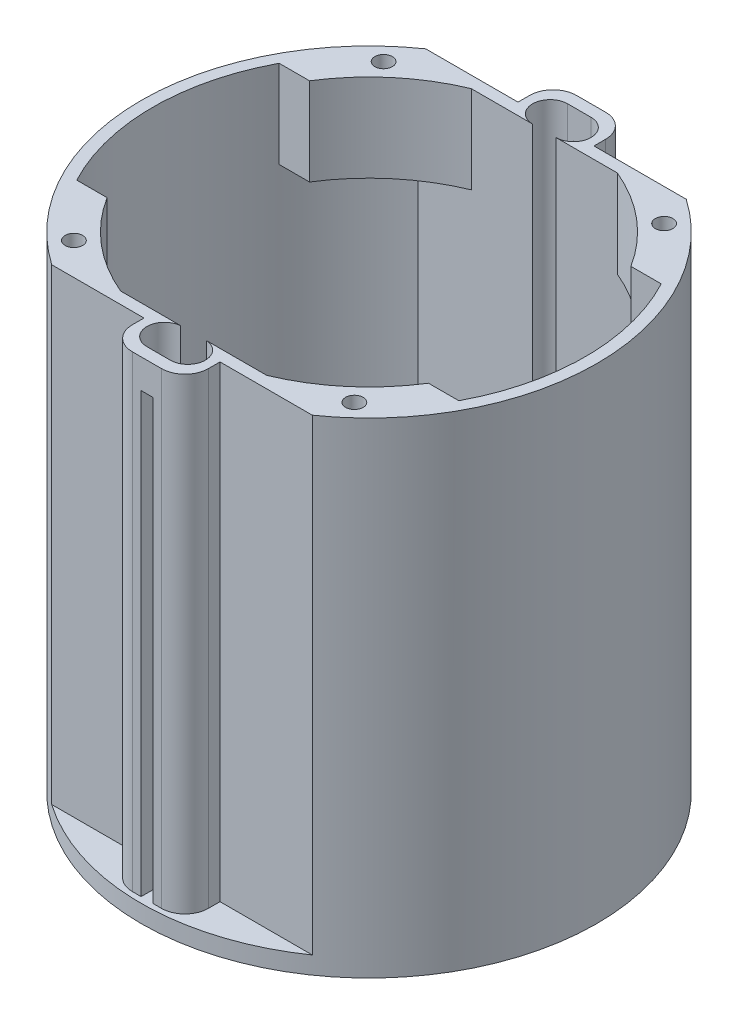
from build123d import *
from build123d.topology import SkipClean

# Parameters (mm, degrees)
SALIENTE_EXTRUIR2_DEPTH   = 80
SALIENTE_EXTRUIR2_2_DEPTH = 80
SALIENTE_EXTRUIR2_3_DEPTH = 80
SALIENTE_EXTRUIR2_4_DEPTH = 80
CROQUIS1_4_R              = 47
CROQUIS1_4_R_2            = 30
SALIENTE_EXTRUIR3_DEPTH   = 3
CROQUIS2_R                = 47
SALIENTE_EXTRUIR4_DEPTH   = 3
CROQUIS3_R                = 1.5
CORTAR_EXTRUIR1_DEPTH     = 7
SALIENTE_EXTRUIR6_DEPTH   = 80
CROQUIS8_W                = 18.419871589
CROQUIS8_H                = 3
SALIENTE_EXTRUIR7_DEPTH   = 2
CROQUIS9_W                = 18.419871589
CROQUIS9_H                = 3
SALIENTE_EXTRUIR8_DEPTH   = 2
CROQUIS10_W               = 18.419871589
CROQUIS10_H               = 3
SALIENTE_EXTRUIR9_DEPTH   = 2
CROQUIS11_W               = 18.419871589
CROQUIS11_H               = 3
SALIENTE_EXTRUIR10_DEPTH  = 2
CORTAR_EXTRUIR2_START     = -4
CROQUIS12_R               = 40.558599581
CROQUIS12_R_2             = 39
CORTAR_EXTRUIR2_DEPTH     = 4
CROQUIS13_W               = 2
CROQUIS13_H               = 5
SALIENTE_EXTRUIR11_DEPTH  = 2
CROQUIS14_W               = 2
CROQUIS14_H               = 5
SALIENTE_EXTRUIR12_DEPTH  = 2
CORTAR_EXTRUIR3_START     = -3
CROQUIS15_R               = 47
CROQUIS15_R_2             = 39
CORTAR_EXTRUIR3_DEPTH     = 3
CROQUIS16_R               = 1.75
CORTAR_EXTRUIR4_DEPTH     = 3
SALIENTE_EXTRUIR13_DEPTH  = 80
CORTAR_EXTRUIR5_DEPTH     = 80
SALIENTE_EXTRUIR14_DEPTH  = 80
SALIENTE_EXTRUIR16_START  = -80
SALIENTE_EXTRUIR16_DEPTH  = 80
CORTAR_EXTRUIR6_DEPTH     = 65
CORTAR_EXTRUIR7_START     = -65
CORTAR_EXTRUIR7_DEPTH     = 65


with BuildPart() as part:
    # Croquis1 → Saliente-Extruir2 (new body)
    with BuildSketch(Plane(origin=(0, 0, 0), x_dir=(1, 0, 0), z_dir=(0, 1, 0))):
        with BuildLine():
            ThreePointArc((-12.5, 30), (-20.980762114, 24.820508076), (-27.5, 17.320508076))
            Line((-27.5, 17.320508076), (-27.5, 27.654113618))
            ThreePointArc((-27.5, 27.654113618), (-26.236168357, 28.855908752), (-24.919871589, 30))
            Line((-24.919871589, 30), (-12.5, 30))
        make_face()
    extrude(amount=SALIENTE_EXTRUIR2_DEPTH)



with BuildPart() as body_2:
    # Croquis1 → Saliente-Extruir2 2 (new body)
    with BuildSketch(Plane(origin=(0, 0, 0), x_dir=(1, 0, 0), z_dir=(0, 1, 0))):
        with BuildLine():
            ThreePointArc((-24.919871589, -30), (-26.236168357, -28.855908752), (-27.5, -27.654113618))
            Line((-27.5, -27.654113618), (-27.5, -17.320508076))
            ThreePointArc((-27.5, -17.320508076), (-20.980762114, -24.820508076), (-12.5, -30))
            Line((-12.5, -30), (-24.919871589, -30))
        make_face()
    extrude(amount=SALIENTE_EXTRUIR2_2_DEPTH)


with BuildPart() as body_3:
    # Croquis1 → Saliente-Extruir2 3 (new body)
    with BuildSketch(Plane(origin=(0, 0, 0), x_dir=(1, 0, 0), z_dir=(0, 1, 0))):
        with BuildLine():
            ThreePointArc((12.5, -30), (20.980762114, -24.820508076), (27.5, -17.320508076))
            Line((27.5, -17.320508076), (27.5, -27.654113618))
            ThreePointArc((27.5, -27.654113618), (26.236168357, -28.855908752), (24.919871589, -30))
            Line((24.919871589, -30), (12.5, -30))
        make_face()
    extrude(amount=SALIENTE_EXTRUIR2_3_DEPTH)


with BuildPart() as body_4:
    # Croquis1 → Saliente-Extruir2 4 (new body)
    with BuildSketch(Plane(origin=(0, 0, 0), x_dir=(1, 0, 0), z_dir=(0, 1, 0))):
        with BuildLine():
            ThreePointArc((24.919871589, 30), (26.236168357, 28.855908752), (27.5, 27.654113618))
            Line((27.5, 27.654113618), (27.5, 17.320508076))
            ThreePointArc((27.5, 17.320508076), (20.980762114, 24.820508076), (12.5, 30))
            Line((12.5, 30), (24.919871589, 30))
        make_face()
    extrude(amount=SALIENTE_EXTRUIR2_4_DEPTH)


with BuildPart() as body_5:
    # Croquis1<4> → Saliente-Extruir3 (new body)
    # profile 1 of 2: a face of its own
    with BuildSketch(Plane(origin=(0, 0, 0), x_dir=(1, 0, 0), z_dir=(0, 1, 0))):
        with Locations(Location((0, 0, 0), (0, 0, 270))):
            Circle(CROQUIS1_4_R)
        Circle(CROQUIS1_4_R_2, mode=Mode.SUBTRACT)
        with BuildLine():
            Line((-24.919871589, 30), (-12.5, 30))
            ThreePointArc((-12.5, 30), (-20.980762114, 24.820508076), (-27.5, 17.320508076))
            Line((-27.5, 17.320508076), (-27.5, 27.654113618))
            ThreePointArc((-27.5, 27.654113618), (-26.236168357, 28.855908752), (-24.919871589, 30))
        make_face(mode=Mode.SUBTRACT)
        with BuildLine():
            Line((24.919871589, 30), (12.5, 30))
            ThreePointArc((12.5, 30), (20.980762114, 24.820508076), (27.5, 17.320508076))
            Line((27.5, 17.320508076), (27.5, 27.654113618))
            ThreePointArc((27.5, 27.654113618), (26.236168357, 28.855908752), (24.919871589, 30))
        make_face(mode=Mode.SUBTRACT)
        with BuildLine():
            Line((-24.919871589, -30), (-12.5, -30))
            ThreePointArc((-12.5, -30), (-20.980762114, -24.820508076), (-27.5, -17.320508076))
            Line((-27.5, -17.320508076), (-27.5, -27.654113618))
            ThreePointArc((-27.5, -27.654113618), (-26.236168357, -28.855908752), (-24.919871589, -30))
        make_face(mode=Mode.SUBTRACT)
        with BuildLine():
            Line((24.919871589, -30), (12.5, -30))
            ThreePointArc((12.5, -30), (20.980762114, -24.820508076), (27.5, -17.320508076))
            Line((27.5, -17.320508076), (27.5, -27.654113618))
            ThreePointArc((27.5, -27.654113618), (26.236168357, -28.855908752), (24.919871589, -30))
        make_face(mode=Mode.SUBTRACT)
    # profile 2 of 2: a face of its own
    with BuildSketch(Plane(origin=(0, 0, 0), x_dir=(1, 0, 0), z_dir=(0, 1, 0))):
        Circle(CROQUIS1_4_R_2)
    extrude(amount=-SALIENTE_EXTRUIR3_DEPTH)


with BuildPart() as part_1:
    add(part.part)

    add(body_2.part)  # Saliente-Extruir4 merges body 2

    add(body_3.part)  # Saliente-Extruir4 merges body 3

    add(body_4.part)  # Saliente-Extruir4 merges body 4

    add(body_5.part)  # Saliente-Extruir4 merges body 5
    # Croquis2 → Saliente-Extruir4 (add)
    with BuildSketch(Plane.XZ.offset(3)):
        with Locations(Location((0, 0, 0), (0, 0, 270))):
            Circle(CROQUIS2_R)
    extrude(amount=-SALIENTE_EXTRUIR4_DEPTH)

    # Croquis3 → Cortar-Extruir1 (cut)
    with BuildSketch(Plane(origin=(0, 80, 0), x_dir=(1, 0, 0), z_dir=(0, 1, 0))):
        with Locations(Location((-24, 26.5, 0), (0, 0, 270))):
            Circle(CROQUIS3_R)
        with Locations(Location((24, 26.5, 0), (0, 0, 90))):
            Circle(CROQUIS3_R)
        with Locations(Location((-24, -26.5, 0), (0, 0, 90))):
            Circle(CROQUIS3_R)
        with Locations(Location((24, -26.5, 0), (0, 0, 270))):
            Circle(CROQUIS3_R)
    extrude(amount=-CORTAR_EXTRUIR1_DEPTH, mode=Mode.SUBTRACT)

    # Croquis4 → Saliente-Extruir6 (add)
    with BuildSketch(Plane(origin=(0, 0, 0), x_dir=(1, 0, 0), z_dir=(0, 1, 0))):
        with BuildLine():
            Line((4, -30), (2.5, -30))
            ThreePointArc((2.5, -30), (2.365938432, -30.002247194), (2.232027496, -30.008986252))
            ThreePointArc((2.232027496, -30.008986252), (4.997752595, -33.116100723), (2, -36))
            Line((2, -36), (1, -36))
            Line((1, -36), (1, -38))
            Line((1, -38), (2.5, -38))
            ThreePointArc((2.5, -38), (5.328427125, -36.828427125), (6.5, -34))
            Line((6.5, -34), (6.5, -30))
            Line((6.5, -30), (4, -30))
        make_face()
        with BuildLine():
            Line((-4, -30), (-6.5, -30))
            Line((-6.5, -30), (-6.5, -34))
            ThreePointArc((-6.5, -34), (-5.328427125, -36.828427125), (-2.5, -38))
            Line((-2.5, -38), (-1, -38))
            Line((-1, -38), (-1, -36))
            Line((-1, -36), (-2, -36))
            ThreePointArc((-2, -36), (-4.997752595, -33.116100723), (-2.232027496, -30.008986252))
            ThreePointArc((-2.232027496, -30.008986252), (-2.365938432, -30.002247194), (-2.5, -30))
            Line((-2.5, -30), (-4, -30))
        make_face()
        with BuildLine():
            Line((2, 30), (6.5, 30))
            Line((6.5, 30), (6.5, 34))
            ThreePointArc((6.5, 34), (5.328427125, 36.828427125), (2.5, 38))
            Line((2.5, 38), (1, 38))
            Line((1, 38), (1, 36))
            Line((1, 36), (2, 36))
            ThreePointArc((2, 36), (5, 33), (2, 30))
        make_face()
        with BuildLine():
            Line((-6.5, 30), (-2, 30))
            ThreePointArc((-2, 30), (-5, 33), (-2, 36))
            Line((-2, 36), (-1, 36))
            Line((-1, 36), (-1, 38))
            Line((-1, 38), (-2.5, 38))
            ThreePointArc((-2.5, 38), (-5.328427125, 36.828427125), (-6.5, 34))
            Line((-6.5, 34), (-6.5, 30))
        make_face()
    extrude(amount=SALIENTE_EXTRUIR6_DEPTH)

    # Croquis8 → Saliente-Extruir7 (add)
    with BuildSketch(Plane.XY.offset(30)):
        with Locations((-15.709935795, 78.5)):
            Rectangle(CROQUIS8_W, CROQUIS8_H)
    extrude(amount=SALIENTE_EXTRUIR7_DEPTH)

    # Croquis9 → Saliente-Extruir8 (add)
    with BuildSketch(Plane.XY.offset(30)):
        with Locations((15.709935795, 78.5)):
            Rectangle(CROQUIS9_W, CROQUIS9_H)
    extrude(amount=SALIENTE_EXTRUIR8_DEPTH)

    # Croquis10 → Saliente-Extruir9 (add)
    with BuildSketch(Plane(origin=(0, 0, -30), x_dir=(-1, 0, 0), z_dir=(0, 0, -1))):
        with Locations((15.709935795, 78.5)):
            Rectangle(CROQUIS10_W, CROQUIS10_H)
    extrude(amount=SALIENTE_EXTRUIR9_DEPTH)

    # Croquis11 → Saliente-Extruir10 (add)
    with BuildSketch(Plane(origin=(0, 0, -30), x_dir=(-1, 0, 0), z_dir=(0, 0, -1))):
        with Locations((-15.709935795, 78.5)):
            Rectangle(CROQUIS11_W, CROQUIS11_H)
    extrude(amount=SALIENTE_EXTRUIR10_DEPTH)

    # Croquis12 → Cortar-Extruir2 (cut)
    with SkipClean():  # the faces are left unmerged after this step: merging them gives an invalid solid
        with BuildSketch(Plane(origin=(0, 80, 0), x_dir=(1, 0, 0), z_dir=(0, 1, 0)).offset(CORTAR_EXTRUIR2_START)):
            Circle(CROQUIS12_R)
            Circle(CROQUIS12_R_2, mode=Mode.SUBTRACT)
        extrude(amount=CORTAR_EXTRUIR2_DEPTH, mode=Mode.SUBTRACT)

    # Croquis13 → Saliente-Extruir11 (add)
    with SkipClean():  # the faces are left unmerged after this step: merging them gives an invalid solid
        with BuildSketch(Plane.ZY.offset(-1)):
            with Locations((37, 77.5)):
                Rectangle(CROQUIS13_W, CROQUIS13_H)
        extrude(amount=SALIENTE_EXTRUIR11_DEPTH)

    # Croquis14 → Saliente-Extruir12 (add)
    with SkipClean():  # the faces are left unmerged after this step: merging them gives an invalid solid
        with BuildSketch(Plane(origin=(-1, 0, 0), x_dir=(0, 0, -1), z_dir=(1, 0, 0))):
            with Locations((37, 77.5)):
                Rectangle(CROQUIS14_W, CROQUIS14_H)
        extrude(amount=SALIENTE_EXTRUIR12_DEPTH)

    # Croquis15 → Cortar-Extruir3 (cut)
    with BuildSketch(Plane(origin=(0, 0, 0), x_dir=(1, 0, 0), z_dir=(0, 1, 0)).offset(CORTAR_EXTRUIR3_START)):
        Circle(CROQUIS15_R)
        with Locations(Location((0, 0, 0), (0, 0, 55.136162046))):
            Circle(CROQUIS15_R_2, mode=Mode.SUBTRACT)
    extrude(amount=CORTAR_EXTRUIR3_DEPTH, mode=Mode.SUBTRACT)

    # Croquis16 → Cortar-Extruir4 (cut)
    with BuildSketch(Plane(origin=(0, 0, 0), x_dir=(1, 0, 0), z_dir=(0, 1, 0))):
        with Locations(Location((-20, 20, 0), (0, 0, 270))):
            Circle(CROQUIS16_R)
        with Locations(Location((-20, -20, 0), (0, 0, 90))):
            Circle(CROQUIS16_R)
        with Locations(Location((20, -20, 0), (0, 0, 270))):
            Circle(CROQUIS16_R)
        with Locations(Location((20, 20, 0), (0, 0, 90))):
            Circle(CROQUIS16_R)
        with BuildLine():
            Line((-5, 5), (-5, 11.456439237))
            ThreePointArc((-5, 11.456439237), (-8.838834765, 8.838834765), (-11.456439237, 5))
            Line((-11.456439237, 5), (-5, 5))
        make_face()
        with BuildLine():
            Line((-5, -5), (-5, -11.456439237))
            ThreePointArc((-5, -11.456439237), (-8.838834765, -8.838834765), (-11.456439237, -5))
            Line((-11.456439237, -5), (-5, -5))
        make_face()
        with BuildLine():
            Line((5, -5), (5, -11.456439237))
            ThreePointArc((5, -11.456439237), (8.838834765, -8.838834765), (11.456439237, -5))
            Line((11.456439237, -5), (5, -5))
        make_face()
        with BuildLine():
            Line((5, 5), (5, 11.456439237))
            ThreePointArc((5, 11.456439237), (8.838834765, 8.838834765), (11.456439237, 5))
            Line((11.456439237, 5), (5, 5))
        make_face()
        with BuildLine():
            Line((5, 16.770509831), (5, 21.937410968))
            ThreePointArc((5, 21.937410968), (15.909902577, 15.909902577), (21.937410968, 5))
            Line((21.937410968, 5), (16.770509831, 5))
            ThreePointArc((16.770509831, 5), (12.374368671, 12.374368671), (5, 16.770509831))
        make_face()
        with BuildLine():
            Line((16.770509831, -5), (21.937410968, -5))
            ThreePointArc((21.937410968, -5), (15.909902577, -15.909902577), (5, -21.937410968))
            Line((5, -21.937410968), (5, -16.770509831))
            ThreePointArc((5, -16.770509831), (12.374368671, -12.374368671), (16.770509831, -5))
        make_face()
        with BuildLine():
            Line((-5, -16.770509831), (-5, -21.937410968))
            ThreePointArc((-5, -21.937410968), (-15.909902577, -15.909902577), (-21.937410968, -5))
            Line((-21.937410968, -5), (-16.770509831, -5))
            ThreePointArc((-16.770509831, -5), (-12.374368671, -12.374368671), (-5, -16.770509831))
        make_face()
        with BuildLine():
            Line((-16.770509831, 5), (-21.937410968, 5))
            ThreePointArc((-21.937410968, 5), (-15.909902577, 15.909902577), (-5, 21.937410968))
            Line((-5, 21.937410968), (-5, 16.770509831))
            ThreePointArc((-5, 16.770509831), (-12.374368671, 12.374368671), (-16.770509831, 5))
        make_face()
    extrude(amount=-CORTAR_EXTRUIR4_DEPTH, mode=Mode.SUBTRACT)

    # Croquis17 → Saliente-Extruir13 (add)
    with BuildSketch(Plane(origin=(0, 0, 0), x_dir=(1, 0, 0), z_dir=(0, 1, 0))):
        with BuildLine():
            Line((24.919871589, 30), (6.5, 30))
            Line((6.5, 30), (6.5, 32))
            Line((6.5, 32), (22.29349681, 32))
            ThreePointArc((22.29349681, 32), (23.627855148, 31.027801423), (24.919871589, 30))
        make_face()
        with BuildLine():
            ThreePointArc((-24.919871589, 30), (-23.627855148, 31.027801423), (-22.29349681, 32))
            Line((-22.29349681, 32), (-6.5, 32))
            Line((-6.5, 32), (-6.5, 30))
            Line((-6.5, 30), (-24.919871589, 30))
        make_face()
        with BuildLine():
            ThreePointArc((24.919871589, -30), (23.627855148, -31.027801423), (22.29349681, -32))
            Line((22.29349681, -32), (6.5, -32))
            Line((6.5, -32), (6.5, -30))
            Line((6.5, -30), (24.919871589, -30))
        make_face()
        with BuildLine():
            Line((-24.919871589, -30), (-6.5, -30))
            Line((-6.5, -30), (-6.5, -32))
            Line((-6.5, -32), (-22.29349681, -32))
            ThreePointArc((-22.29349681, -32), (-23.627855148, -31.027801423), (-24.919871589, -30))
        make_face()
    extrude(amount=SALIENTE_EXTRUIR13_DEPTH)

    # Croquis20 → Cortar-Extruir5 (cut)
    with BuildSketch(Plane(origin=(27.5, 0, 0), x_dir=(0, 0, -1), z_dir=(1, 0, 0))):
        with BuildLine():
            ThreePointArc((24.494897428, 65), (21.082205203, 67.938157129), (17.320508076, 70.413812651))
            Line((17.320508076, 70.413812651), (17.320508076, 64.494897428))
            ThreePointArc((17.320508076, 64.494897428), (21.213203436, 61.213203436), (24.494897428, 57.320508076))
            Line((24.494897428, 57.320508076), (24.494897428, 65))
        make_face()
        with BuildLine():
            ThreePointArc((24.494897428, 45), (21.898918773, 52.059741149), (17.320508076, 58.027756377))
            Line((17.320508076, 58.027756377), (17.320508076, 50))
            ThreePointArc((17.320508076, 50), (18.512295868, 47.569339581), (19.364916731, 45))
            Line((19.364916731, 45), (24.494897428, 45))
        make_face()
        with BuildLine():
            ThreePointArc((19.364916731, 35), (18.512295868, 32.430660419), (17.320508076, 30))
            Line((17.320508076, 30), (17.320508076, 21.972243623))
            ThreePointArc((17.320508076, 21.972243623), (21.898918773, 27.940258851), (24.494897428, 35))
            Line((24.494897428, 35), (19.364916731, 35))
        make_face()
        with BuildLine():
            ThreePointArc((24.494897428, 22.679491924), (21.213203436, 18.786796564), (17.320508076, 15.505102572))
            Line((17.320508076, 15.505102572), (17.320508076, 9.586187349))
            ThreePointArc((17.320508076, 9.586187349), (21.082205203, 12.061842871), (24.494897428, 15))
            Line((24.494897428, 15), (24.494897428, 22.679491924))
        make_face()
    extrude(amount=-CORTAR_EXTRUIR5_DEPTH, mode=Mode.SUBTRACT)

    # Croquis21 → Saliente-Extruir14 (add)
    with SkipClean():  # the faces are left unmerged after this step: merging them gives an invalid solid
        with BuildSketch(Plane(origin=(0, 0, 0), x_dir=(1, 0, 0), z_dir=(0, 1, 0))):
            with BuildLine():
                Line((27.5, 27.654113618), (27.5, 24.753787589))
                ThreePointArc((27.5, 24.753787589), (37, 0), (27.5, -24.753787589))
                Line((27.5, -24.753787589), (27.5, -27.654113618))
                ThreePointArc((27.5, -27.654113618), (39, 0), (27.5, 27.654113618))
            make_face()
            with BuildLine():
                Line((-27.5, -27.654113618), (-27.5, -24.753787589))
                ThreePointArc((-27.5, -24.753787589), (-37, 0), (-27.5, 24.753787589))
                Line((-27.5, 24.753787589), (-27.5, 27.654113618))
                ThreePointArc((-27.5, 27.654113618), (-39, 0), (-27.5, -27.654113618))
            make_face()
        extrude(amount=SALIENTE_EXTRUIR14_DEPTH)

    # Croquis22 → Saliente-Extruir16 (add)
    with SkipClean():  # the faces are left unmerged after this step: merging them gives an invalid solid
        with BuildSketch(Plane(origin=(0, 80, 0), x_dir=(1, 0, 0), z_dir=(0, 1, 0)).offset(SALIENTE_EXTRUIR16_START)):
            with BuildLine():
                ThreePointArc((-32.695565449, -17.320508076), (-30.326390092, -21.19693525), (-27.5, -24.753787589))
                Line((-27.5, -24.753787589), (-27.5, -17.320508076))
                Line((-27.5, -17.320508076), (-32.695565449, -17.320508076))
            make_face()
            with BuildLine():
                Line((-27.5, -17.320508076), (-27.5, -24.753787589))
                Line((-27.5, -24.753787589), (-20.980762114, -24.820508076))
                ThreePointArc((-20.980762114, -24.820508076), (-24.528729559, -21.32114974), (-27.5, -17.320508076))
            make_face()
            with BuildLine():
                ThreePointArc((27.5, -24.753787589), (30.326390092, -21.19693525), (32.695565449, -17.320508076))
                Line((32.695565449, -17.320508076), (27.5, -17.320508076))
                Line((27.5, -17.320508076), (27.5, -24.753787589))
            make_face()
            with BuildLine():
                Line((27.5, -24.753787589), (27.5, -17.320508076))
                ThreePointArc((27.5, -17.320508076), (24.528729559, -21.32114974), (20.980762114, -24.820508076))
                Line((20.980762114, -24.820508076), (27.5, -24.753787589))
            make_face()
            with BuildLine():
                Line((27.5, 17.320508076), (27.5, 24.753787589))
                Line((27.5, 24.753787589), (20.980762114, 24.820508076))
                ThreePointArc((20.980762114, 24.820508076), (24.528729559, 21.32114974), (27.5, 17.320508076))
            make_face()
            with BuildLine():
                ThreePointArc((32.695565449, 17.320508076), (30.326390092, 21.19693525), (27.5, 24.753787589))
                Line((27.5, 24.753787589), (27.5, 17.320508076))
                Line((27.5, 17.320508076), (32.695565449, 17.320508076))
            make_face()
            with BuildLine():
                ThreePointArc((-27.5, 24.753787589), (-30.326390092, 21.19693525), (-32.695565449, 17.320508076))
                Line((-32.695565449, 17.320508076), (-27.5, 17.320508076))
                Line((-27.5, 17.320508076), (-27.5, 24.753787589))
            make_face()
            with BuildLine():
                Line((-27.5, 24.753787589), (-27.5, 17.320508076))
                ThreePointArc((-27.5, 17.320508076), (-24.528729559, 21.32114974), (-20.980762114, 24.820508076))
                Line((-20.980762114, 24.820508076), (-27.5, 24.753787589))
            make_face()
        extrude(amount=SALIENTE_EXTRUIR16_DEPTH)

    # Croquis25 → Cortar-Extruir6 (cut)
    with SkipClean():  # the faces are left unmerged after this step: merging them gives an invalid solid
        with BuildSketch(Plane(origin=(0, 0, 0), x_dir=(1, 0, 0), z_dir=(0, 1, 0))):
            with BuildLine():
                Line((27.5, 17.320508076), (32.695565449, 17.320508076))
                ThreePointArc((32.695565449, 17.320508076), (27.905673771, 24.295542212), (21.656407828, 30))
                Line((21.656407828, 30), (12.5, 30))
                ThreePointArc((12.5, 30), (20.980762114, 24.820508076), (27.5, 17.320508076))
            make_face()
            with BuildLine():
                Line((-12.5, 30), (-21.656407828, 30))
                ThreePointArc((-21.656407828, 30), (-27.905673771, 24.295542212), (-32.695565449, 17.320508076))
                Line((-32.695565449, 17.320508076), (-27.5, 17.320508076))
                ThreePointArc((-27.5, 17.320508076), (-20.980762114, 24.820508076), (-12.5, 30))
            make_face()
            with BuildLine():
                Line((-27.5, -17.320508076), (-32.695565449, -17.320508076))
                ThreePointArc((-32.695565449, -17.320508076), (-27.905673771, -24.295542212), (-21.656407828, -30))
                Line((-21.656407828, -30), (-12.5, -30))
                ThreePointArc((-12.5, -30), (-20.980762114, -24.820508076), (-27.5, -17.320508076))
            make_face()
            with BuildLine():
                Line((12.5, -30), (21.656407828, -30))
                ThreePointArc((21.656407828, -30), (27.905673771, -24.295542212), (32.695565449, -17.320508076))
                Line((32.695565449, -17.320508076), (27.5, -17.320508076))
                ThreePointArc((27.5, -17.320508076), (20.980762114, -24.820508076), (12.5, -30))
            make_face()
        extrude(amount=CORTAR_EXTRUIR6_DEPTH, mode=Mode.SUBTRACT)

    # Croquis26 → Cortar-Extruir7 (cut)
    with SkipClean():  # the faces are left unmerged after this step: merging them gives an invalid solid
        with BuildSketch(Plane(origin=(0, 0, 0), x_dir=(1, 0, 0), z_dir=(0, 1, 0)).offset(CORTAR_EXTRUIR7_START)):
            with BuildLine():
                Line((-23.269230769, 14.655814526), (-27.5, 17.320508076))
                ThreePointArc((-27.5, 17.320508076), (-32.5, 0), (-27.5, -17.320508076))
                Line((-27.5, -17.320508076), (-23.269230769, -14.655814526))
                ThreePointArc((-23.269230769, -14.655814526), (-27.5, 0), (-23.269230769, 14.655814526))
            make_face()
            with BuildLine():
                Line((23.269230769, 14.655814526), (27.5, 17.320508076))
                ThreePointArc((27.5, 17.320508076), (32.5, 0), (27.5, -17.320508076))
                Line((27.5, -17.320508076), (23.269230769, -14.655814526))
                ThreePointArc((23.269230769, -14.655814526), (27.5, 0), (23.269230769, 14.655814526))
            make_face()
        extrude(amount=CORTAR_EXTRUIR7_DEPTH, mode=Mode.SUBTRACT)


solid = part_1.part
